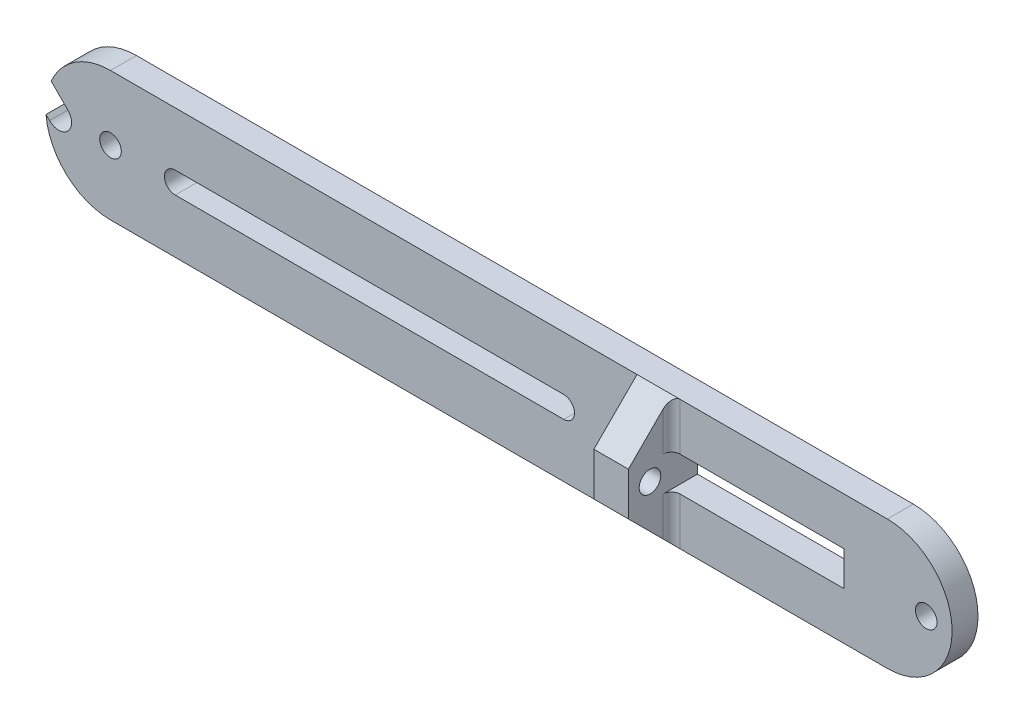
from build123d import *

# Parameters (mm, degrees)
ESQUISSE1_R             = 2.5
ESQUISSE1_W             = 40
ESQUISSE1_H             = 8
BOSS_EXTRU_1_DEPTH      = 6
ESQUISSE2_R             = 2.5
BOSS_EXTRU_2_DEPTH      = 8
CONG_2_R                = 2
ENL_V_MAT_EXTRU_1_DEPTH = 4
ENL_V_START             = -10
ENL_V_MAT_EXTRU_4_DEPTH = 10


with BuildPart() as part:
    # Esquisse1 → Boss.-Extru.1 (new body)
    with BuildSketch(Plane.XY):
        with BuildLine():
            Line((90, -15), (-90, -15))
            ThreePointArc((-90, -15), (-105, 0), (-90, 15))
            Line((-90, 15), (90, 15))
            ThreePointArc((90, 15), (105, 0), (90, -15))
        make_face()
        with Locations((99, 0)):
            Circle(ESQUISSE1_R, mode=Mode.SUBTRACT)
        with Locations(Location((-90, 0, 0), (0, 0, 180))):
            Circle(ESQUISSE1_R, mode=Mode.SUBTRACT)
        with BuildLine():
            Line((0, -2.5), (-75, -2.5))
            ThreePointArc((-75, -2.5), (-77.5, 0), (-75, 2.5))
            Line((-75, 2.5), (0, 2.5))
            Line((0, 2.5), (15, 2.5))
            ThreePointArc((15, 2.5), (17.5, 0), (15, -2.5))
            Line((15, -2.5), (0, -2.5))
        make_face(mode=Mode.SUBTRACT)
        with Locations((60, 0)):
            Rectangle(ESQUISSE1_W, ESQUISSE1_H, mode=Mode.SUBTRACT)
    extrude(amount=BOSS_EXTRU_1_DEPTH)

    # Esquisse2 → Boss.-Extru.2 (add)
    with BuildSketch(Plane(origin=(40, 0, 0), x_dir=(0, 0, -1), z_dir=(1, 0, 0))):
        Polygon((-16, 5), (-16, -5), (-6, -15), (-6, -5), (-6, 5), (-6, 15), align=None)
        with Locations((-11, 0)):
            Circle(ESQUISSE2_R, mode=Mode.SUBTRACT)
    extrude(amount=-BOSS_EXTRU_2_DEPTH)

    # Congé2
    cong_2_edges = [part.edges().sort_by_distance(p)[0] for p in [
        (40, 9.5, 6),
        (40, -9.5, 6),
    ]]
    fillet(cong_2_edges, radius=CONG_2_R)

    # Esquisse3 → Enlèv. mat.-Extru.1 (cut)
    with BuildSketch(Plane.ZY.offset(-32)):
        Polygon((11, 4), (14.464101615, 2), (14.464101615, -2), (11, -4), (7.535898385, -2), (7.535898385, 2), align=None)
    extrude(amount=-ENL_V_MAT_EXTRU_1_DEPTH, mode=Mode.SUBTRACT)

    # Esquisse4 → Enlèv. mat.-Extru.4 (cut)
    with BuildSketch(Plane.XY.offset(6).offset(ENL_V_START)):
        with BuildLine():
            ThreePointArc((-105, 0), (-104.771638598, -1.148050297), (-104.121320344, -2.121320344))
            Line((-104.121320344, -2.121320344), (-99.878679656, 2.121320344))
            ThreePointArc((-99.878679656, 2.121320344), (-103.148050297, 2.771638598), (-105, 0))
        make_face()
        with BuildLine():
            Line((-99.878679656, 2.121320344), (-104.121320344, -2.121320344))
            ThreePointArc((-104.121320344, -2.121320344), (-100.851949703, -2.771638598), (-99, 0))
            ThreePointArc((-99, 0), (-99.228361402, 1.148050297), (-99.878679656, 2.121320344))
        make_face()
        with BuildLine():
            ThreePointArc((-105, 0), (-103.148050297, 2.771638598), (-99.878679656, 2.121320344))
            Line((-99.878679656, 2.121320344), (-103.750652313, 5.993293))
            ThreePointArc((-103.750652313, 5.993293), (-104.68434174, 3.061063158), (-105, 0))
        make_face()
        with BuildLine():
            Line((-104.94364809, -1.298992597), (-104.121320344, -2.121320344))
            ThreePointArc((-104.121320344, -2.121320344), (-104.771638598, -1.148050297), (-105, 0))
            ThreePointArc((-105, 0), (-104.985905401, -0.650107165), (-104.94364809, -1.298992597))
        make_face()
        with BuildLine():
            ThreePointArc((-105, 0), (-104.771638598, -1.148050297), (-104.121320344, -2.121320344))
            Line((-104.121320344, -2.121320344), (-99.878679656, 2.121320344))
            ThreePointArc((-99.878679656, 2.121320344), (-103.148050297, 2.771638598), (-105, 0))
        make_face()
        with BuildLine():
            Line((-99.878679656, 2.121320344), (-104.121320344, -2.121320344))
            ThreePointArc((-104.121320344, -2.121320344), (-100.851949703, -2.771638598), (-99, 0))
            ThreePointArc((-99, 0), (-99.228361402, 1.148050297), (-99.878679656, 2.121320344))
        make_face()
    extrude(amount=ENL_V_MAT_EXTRU_4_DEPTH, mode=Mode.SUBTRACT)


solid = part.part
